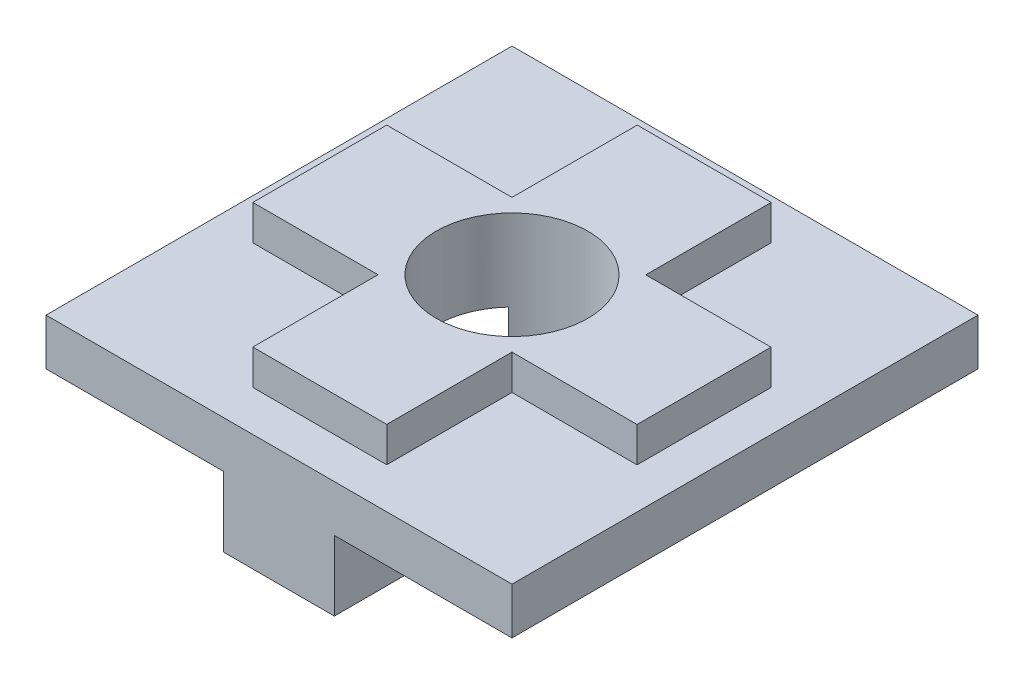
from build123d import *

# Parameters (mm, degrees)
SKETCH1_W                      = 20
SKETCH1_H                      = 20
BOSS_EXTRUDE1_DEPTH            = 2
BOSS_EXTRUDE3_DEPTH            = 1.5
SKETCH6_W                      = 4.75
SKETCH6_H                      = 20
BOSS_EXTRUDE4_DEPTH            = 3
TAP_DRILL_FOR_M2_2_HELICOIL1_D = 6.5


with BuildPart() as part:
    # Sketch1 → Boss-Extrude1 (new body)
    with BuildSketch(Plane(origin=(0, 0, 0), x_dir=(1, 0, 0), z_dir=(0, 1, 0))):
        Rectangle(SKETCH1_W, SKETCH1_H)
    extrude(amount=BOSS_EXTRUDE1_DEPTH)

    # Sketch3 → Boss-Extrude3 (add)
    with BuildSketch(Plane(origin=(0, 2, 0), x_dir=(1, 0, 0), z_dir=(0, 1, 0))):
        Polygon((-2.875, 8.25), (2.875, 8.25), (2.875, 2.867474963), (8.25, 2.867474963), (8.25, -2.882525037), (2.875, -2.875), (2.875, -8.25), (-2.875, -8.25), (-2.875, -2.875), (-8.25, -2.875), (-8.25, 2.875), (-2.875, 2.875), align=None)
    extrude(amount=BOSS_EXTRUDE3_DEPTH)

    # Sketch6 → Boss-Extrude4 (add)
    with BuildSketch(Plane.XZ):
        Rectangle(SKETCH6_W, SKETCH6_H)
    extrude(amount=BOSS_EXTRUDE4_DEPTH)

    # Tap Drill for M2.2 Helicoil1 (through all)
    with Locations(Plane.ZX.offset(3.5)):
        with Locations((0, 0)):
            Hole(TAP_DRILL_FOR_M2_2_HELICOIL1_D / 2)


solid = part.part
